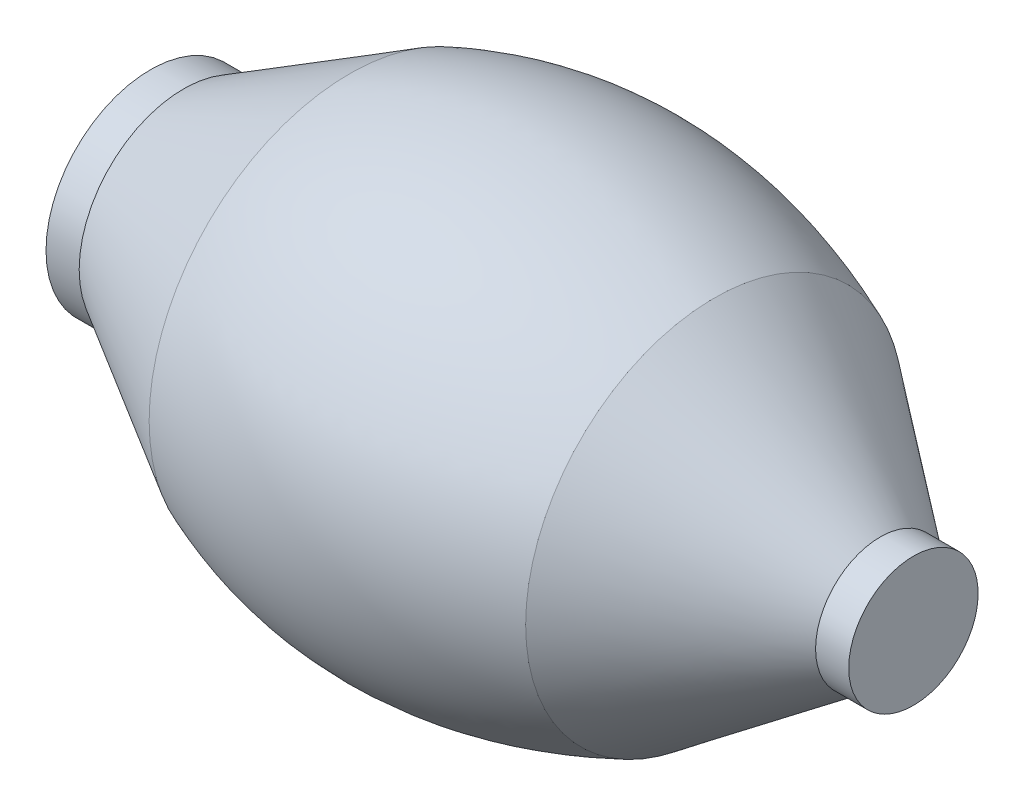
from build123d import *


with BuildPart() as part:
    # Sketch1 → Revolve1 (revolve)
    with BuildSketch(Plane(origin=(0, 0, 0), x_dir=(1, 0, 0), z_dir=(0, 1, 0)), mode=Mode.PRIVATE) as revolve1_sk:
        with BuildLine():
            Line((-50, 60.408992064), (-100, 31.5))
            Line((-100, 31.5), (-110, 31.5))
            Line((-110, 31.5), (-110, 0))
            Line((-110, 0), (0, 0))
            Line((0, 0), (120, 0))
            Line((120, 0), (120, 19.5))
            Line((120, 19.5), (110, 19.5))
            Line((110, 19.5), (60, 56.906674408))
            add(Edge.make_bspline(
                [(-50, 60.408992064), (2.111468829, 81.206167483), (60, 56.906674408)],
                knots=[0, 0, 0, 1, 1, 1], degree=2))
        make_face()
    revolve(revolve1_sk.sketch.rotate(Axis((-72.866242038, 0, 0), (1, 0, 0)), 180), axis=Axis((-72.866242038, 0, 0), (1, 0, 0)))


solid = part.part
